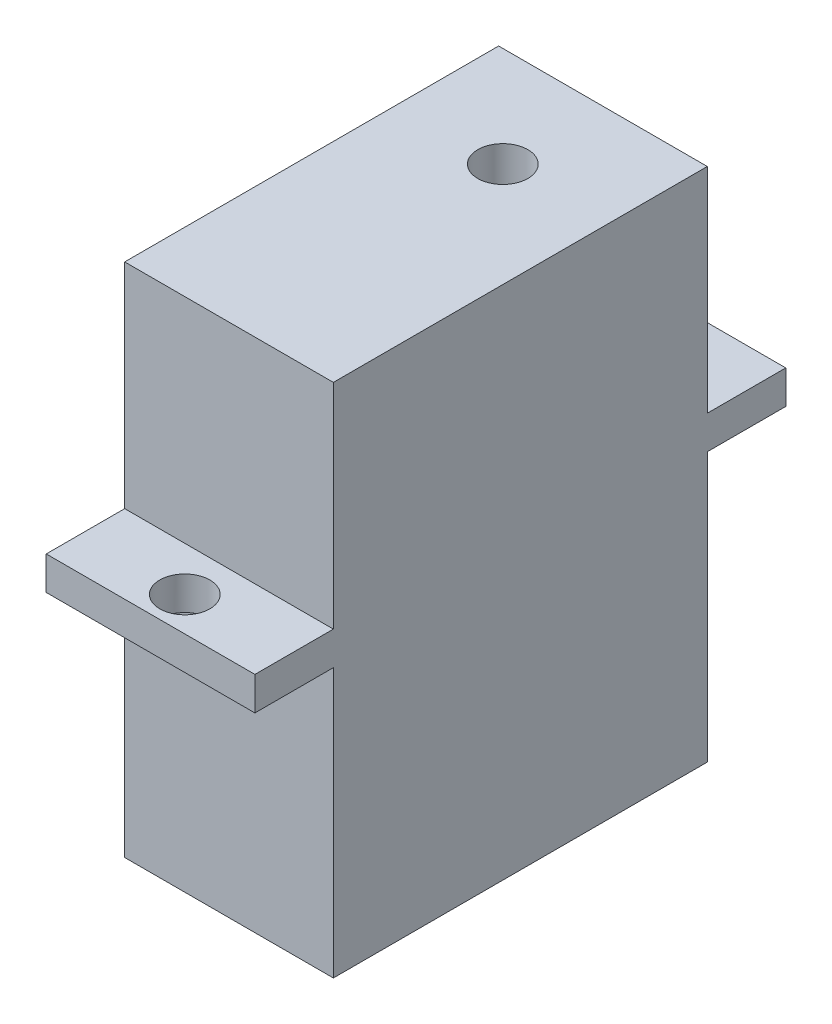
from build123d import *

# Parameters (mm, degrees)
SKETCH_1_W          = 12.5
SKETCH_1_H          = 22.4
EXTRUDE_1_DEPTH     = 30.9
SKETCH_4_W          = 31.8
SKETCH_4_H          = 2
EXTRUDE_2_DEPTH     = 12.5
SKETCH_6_R          = 1.5
CUT_EXTRUDE_2_DEPTH = 25.889405377
SKETCH_7_R          = 1.5
CUT_EXTRUDE_3_DEPTH = 3


with BuildPart() as part:
    # 草图1 → 凸台-拉伸1 (new body)
    with BuildSketch(Plane(origin=(0, 0, 0), x_dir=(1, 0, 0), z_dir=(0, 1, 0))):
        Rectangle(SKETCH_1_W, SKETCH_1_H)
    extrude(amount=EXTRUDE_1_DEPTH)

    # 草图4 → 凸台-拉伸2 (add)
    with BuildSketch(Plane(origin=(6.25, 0, 0), x_dir=(0, 0, -1), z_dir=(1, 0, 0))):
        with Locations((0, 17.1)):
            Rectangle(SKETCH_4_W, SKETCH_4_H)
    extrude(amount=-EXTRUDE_2_DEPTH)

    # 草图6 → 切除-拉伸2 (cut, through all)
    with BuildSketch(Plane(origin=(0, 18.1, 0), x_dir=(1, 0, 0), z_dir=(0, 1, 0))):
        with Locations(Location((0, 13.85, 0), (0, 0, 270))):
            Circle(SKETCH_6_R)
        with Locations(Location((0, -13.85, 0), (0, 0, 270))):
            Circle(SKETCH_6_R)
    extrude(amount=-CUT_EXTRUDE_2_DEPTH, mode=Mode.SUBTRACT)

    # 草图7 → 切除-拉伸3 (cut)
    with BuildSketch(Plane(origin=(0, 30.9, 0), x_dir=(1, 0, 0), z_dir=(0, 1, 0))):
        with Locations(Location((0, 5.2, 0), (0, 0, 270))):
            Circle(SKETCH_7_R)
    extrude(amount=-CUT_EXTRUDE_3_DEPTH, mode=Mode.SUBTRACT)


solid = part.part
